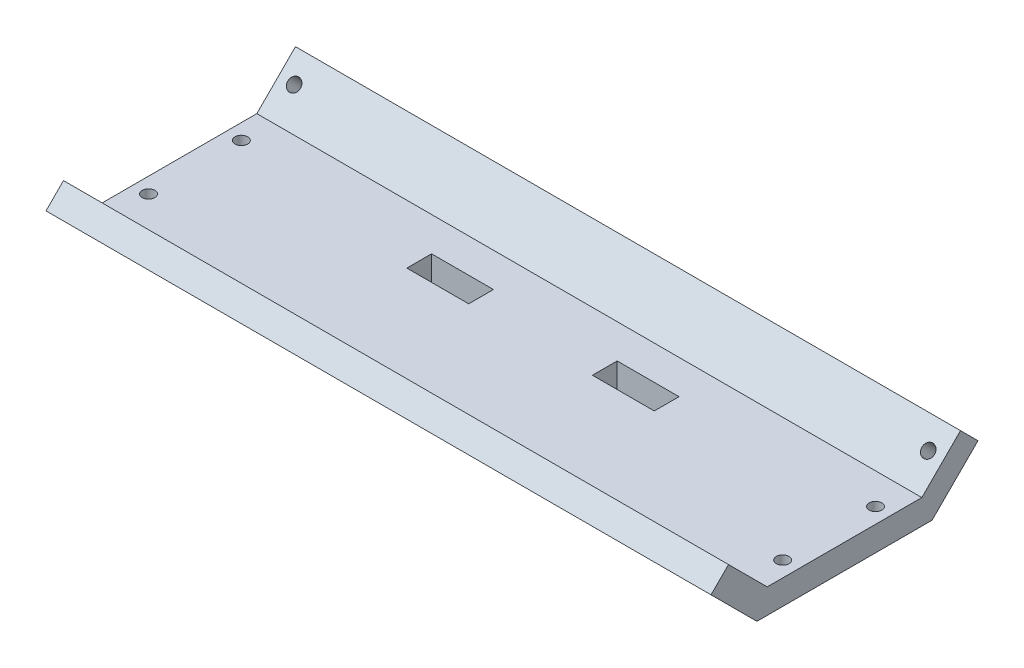
from build123d import *

# Parameters (mm, degrees)
MAIN_DEPTH                      = 107.5
F_4_0MM_DOWEL_HOLE2_D           = 4.1
F_4_0MM_DOWEL_HOLE2_ON_FACE_2_D = 4.1
F_4_0MM_DOWEL_HOLE2_ON_FACE_3_D = 4.1
F_4_0MM_DOWEL_HOLE2_ON_FACE_4_D = 4.1
SKETCH6_W                       = 20
SKETCH6_H                       = 8
SHELF_CUT_DEPTH                 = 117.511862352


with BuildPart() as part:
    # Sketch2 → Main (new, symmetric)
    with BuildSketch(Plane(origin=(0, 0, 0), x_dir=(0, 0, -1), z_dir=(1, 0, 0))):
        Polygon((-25, 0), (25, 0), (37.5, 12.5), (43.156854249, 6.843145751), (28.313708499, -8), (-28.313708499, -8), (-43.156854249, 6.843145751), (-37.5, 12.5), align=None)
    extrude(amount=MAIN_DEPTH, both=True)

    # Ø4.0mm Dowel Hole2 (through all)
    with Locations(Plane(origin=(-102.5, 7.071067812, -32.071067812), x_dir=(0, 0.707106781187, -0.707106781187), z_dir=(0, 0.707106781187, 0.707106781187))):
        with Locations((0, 0)):
            Hole(F_4_0MM_DOWEL_HOLE2_D / 2)

    # Ø4.0mm Dowel Hole2 on face 2 (through all)
    with Locations(Plane(origin=(-102.5, 0, -15), x_dir=(0, 0, 1), z_dir=(0, 1, 0))):
        with Locations((0, 0), (30, 0), (30, 205), (0, 205)):
            Hole(F_4_0MM_DOWEL_HOLE2_ON_FACE_2_D / 2)

    # Ø4.0mm Dowel Hole2 on face 3 (through all)
    with Locations(Plane(origin=(-102.5, 7.071067812, 32.071067812), x_dir=(0, -0.707106781187, -0.707106781187), z_dir=(0, 0.707106781187, -0.707106781187))):
        with Locations((0, 0), (0, -205)):
            Hole(F_4_0MM_DOWEL_HOLE2_ON_FACE_3_D / 2)

    # Ø4.0mm Dowel Hole2 on face 4 (through all)
    with Locations(Plane(origin=(102.5, 7.071067812, -32.071067812), x_dir=(0, 0.707106781187, -0.707106781187), z_dir=(0, 0.707106781187, 0.707106781187))):
        with Locations((0, 0)):
            Hole(F_4_0MM_DOWEL_HOLE2_ON_FACE_4_D / 2)

    # Sketch6 → Shelf cut (cut, through all)
    with BuildSketch(Plane(origin=(0, 0, 0), x_dir=(1, 0, 0), z_dir=(0, 1, 0))):
        with Locations((30, 10)):
            Rectangle(SKETCH6_W, SKETCH6_H)
        with Locations((-30, 10)):
            Rectangle(SKETCH6_W, SKETCH6_H)
    extrude(amount=-SHELF_CUT_DEPTH, mode=Mode.SUBTRACT)


solid = part.part
